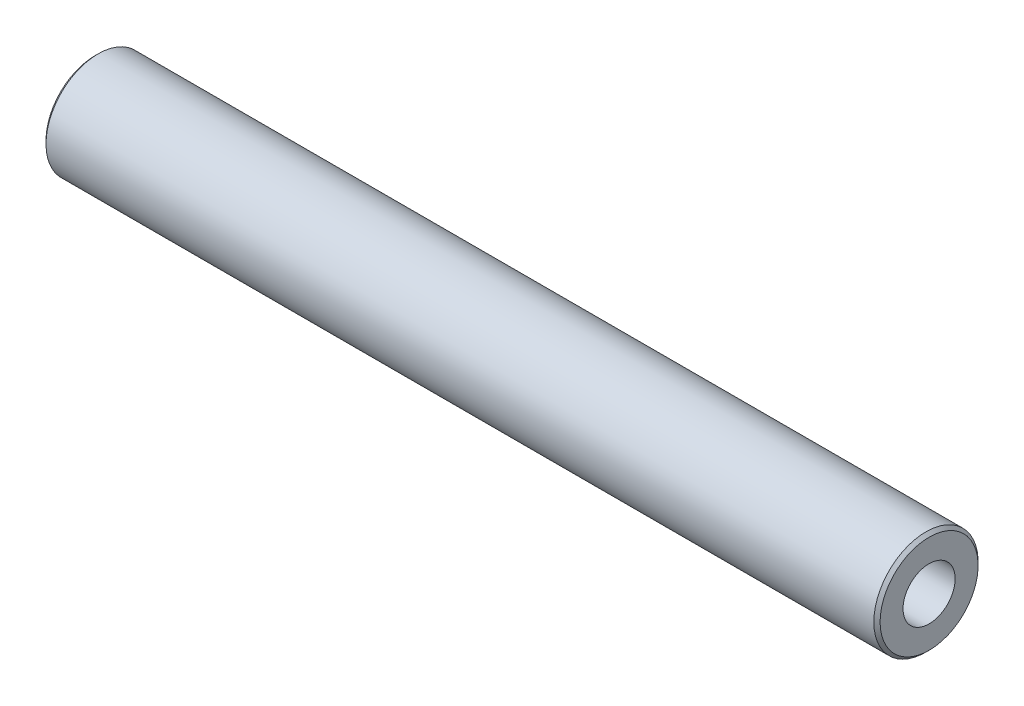
from build123d import *

# Parameters (mm, degrees)
SKETCH_1_W             = 80
SKETCH_1_H             = 5
HOLE_WIZARD_M6_1_D     = 5
HOLE_WIZARD_M6_1_DEPTH = 15
HOLE_WIZARD_M6_1_TIP   = 1.502151548
HOLE_WIZARD_M6_2_D     = 5
HOLE_WIZARD_M6_2_DEPTH = 15
HOLE_WIZARD_M6_2_TIP   = 1.502151548
CHAMFER_1_SIZE         = 0.3


with BuildPart() as part:
    # 草图1 → 旋转1 (revolve)
    with BuildSketch(Plane(origin=(0, 0, 0), x_dir=(1, 0, 0), z_dir=(0, 1, 0)), mode=Mode.PRIVATE) as revolve_1_sk:
        with Locations((40, 2.5)):
            Rectangle(SKETCH_1_W, SKETCH_1_H)
    revolve(revolve_1_sk.sketch.rotate(Axis((-1000, 0, 0), (1, 0, 0)), 180), axis=Axis((-1000, 0, 0), (1, 0, 0)))

    # M6 螺纹孔1
    with Locations(Plane(origin=(80, 0, 0), x_dir=(0, 0, -1), z_dir=(1, 0, 0))):
        with Locations((0, 0)):
            Hole(HOLE_WIZARD_M6_1_D / 2, depth=HOLE_WIZARD_M6_1_DEPTH)
            with Locations((0, 0, -(HOLE_WIZARD_M6_1_DEPTH + HOLE_WIZARD_M6_1_TIP / 2))):  # 118° drill point
                Cone(0, HOLE_WIZARD_M6_1_D / 2, HOLE_WIZARD_M6_1_TIP, mode=Mode.SUBTRACT)

    # M6 螺纹孔2
    with Locations(Plane.ZY):
        with Locations((0, 0)):
            Hole(HOLE_WIZARD_M6_2_D / 2, depth=HOLE_WIZARD_M6_2_DEPTH)
            with Locations((0, 0, -(HOLE_WIZARD_M6_2_DEPTH + HOLE_WIZARD_M6_2_TIP / 2))):  # 118° drill point
                Cone(0, HOLE_WIZARD_M6_2_D / 2, HOLE_WIZARD_M6_2_TIP, mode=Mode.SUBTRACT)

    # 倒角1
    chamfer_1_edges = [part.edges().sort_by_distance(p)[0] for p in [
        (80, 0, -5),
        (0, 0, -5),
    ]]
    chamfer(chamfer_1_edges, length=CHAMFER_1_SIZE)


solid = part.part
